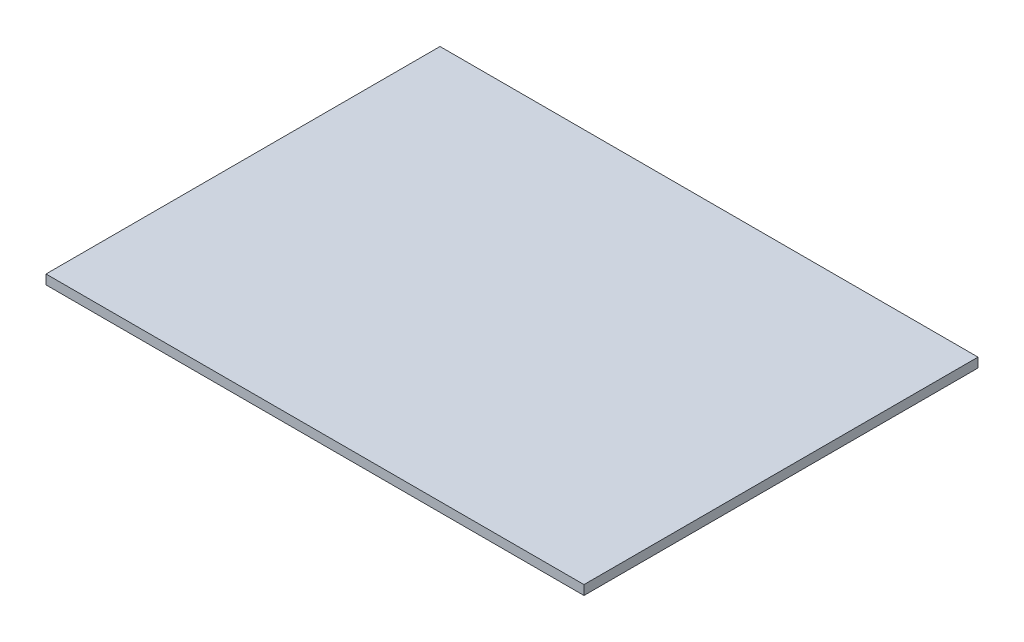
from build123d import *

# Parameters (mm, degrees)
SKETCH2_W           = 90.17
SKETCH2_H           = 66.04
BOSS_EXTRUDE1_DEPTH = 1.5875


with BuildPart() as part:
    # Sketch2 → Boss-Extrude1 (new body)
    with BuildSketch(Plane(origin=(0, 0, 0), x_dir=(1, 0, 0), z_dir=(0, 1, 0))):
        Rectangle(SKETCH2_W, SKETCH2_H)
    extrude(amount=BOSS_EXTRUDE1_DEPTH)


solid = part.part
